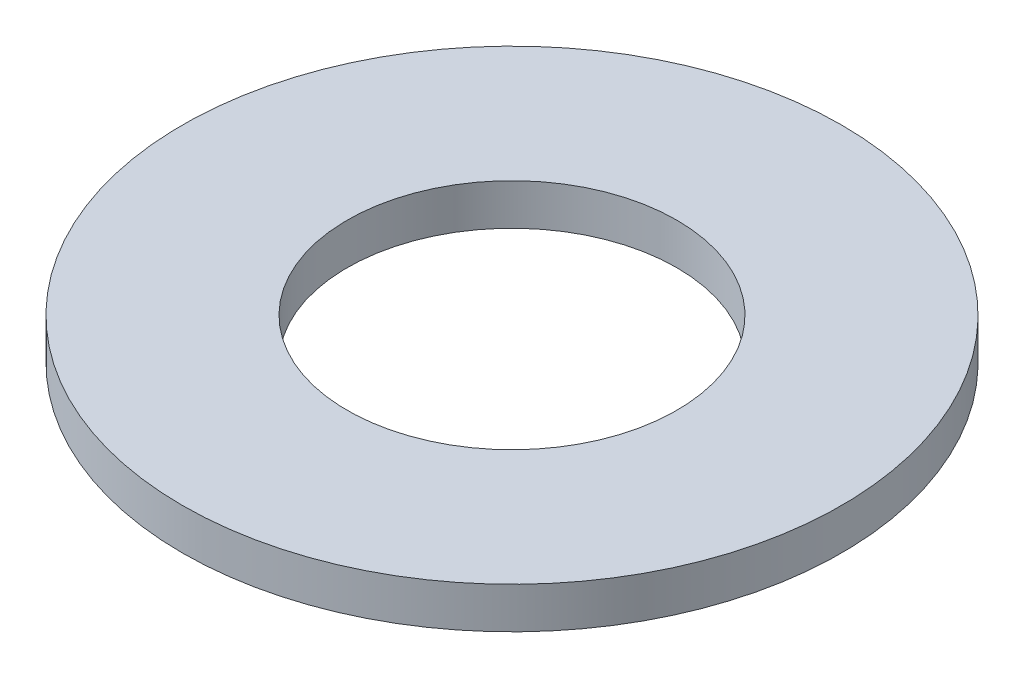
from build123d import *

# Parameters (mm, degrees)
SKETCH1_W = 8
SKETCH1_H = 2


with BuildPart() as part:
    # Sketch1 → Revolve1 (revolve)
    with BuildSketch(Plane.XY, mode=Mode.PRIVATE) as revolve1_sk:
        with Locations((12, 1)):
            Rectangle(SKETCH1_W, SKETCH1_H)
    revolve(revolve1_sk.sketch.rotate(Axis((0, 0, 0), (0, 1, 0)), 90), axis=Axis((0, 0, 0), (0, 1, 0)))


solid = part.part
